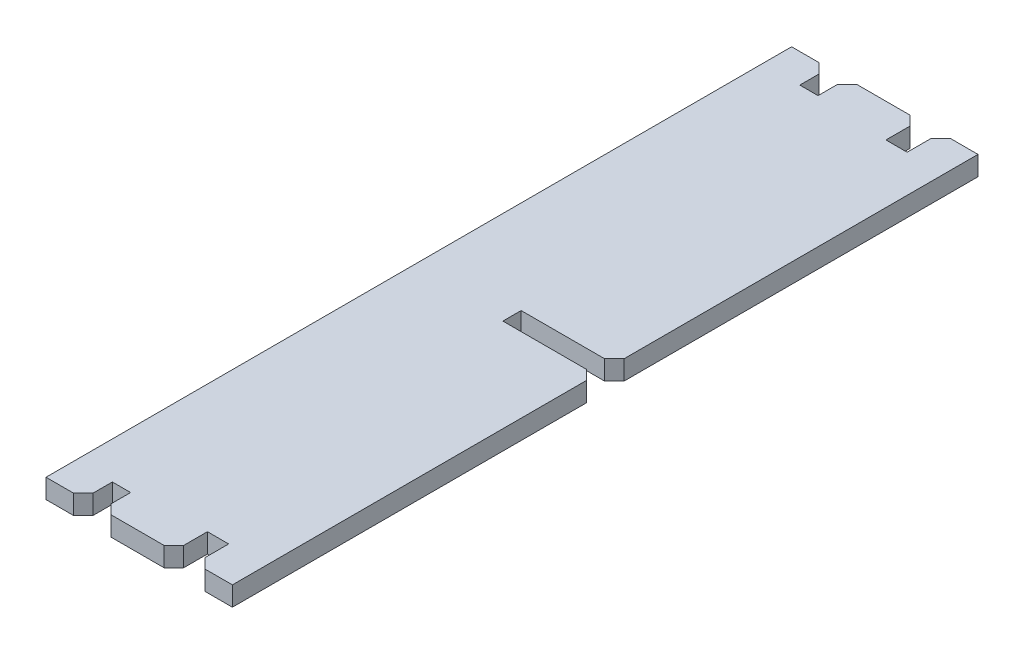
from build123d import *

# Parameters (mm, degrees)
SKETCH1_W           = 50
SKETCH1_H           = 200
BOSS_EXTRUDE1_DEPTH = 5.2
SKETCH2_W           = 4.9
SKETCH2_H           = 7.8
SKETCH2_W_2         = 5.7
SKETCH2_H_2         = 9
SKETCH2_W_3         = 25
SKETCH2_H_3         = 4.9
CUT_EXTRUDE1_DEPTH  = 5.2
CHAMFER2_SIZE       = 2.6


with BuildPart() as part:
    # Sketch1 → Boss-Extrude1 (new body)
    with BuildSketch(Plane(origin=(0, 0, 0), x_dir=(1, 0, 0), z_dir=(0, 1, 0))):
        with Locations((25, 100)):
            Rectangle(SKETCH1_W, SKETCH1_H)
    extrude(amount=BOSS_EXTRUDE1_DEPTH)

    # Sketch2 → Cut-Extrude1 (cut)
    with BuildSketch(Plane(origin=(0, 5.2, 0), x_dir=(1, 0, 0), z_dir=(0, 1, 0))):
        with Locations((12.45, 196.1)):
            Rectangle(SKETCH2_W, SKETCH2_H)
        with Locations((37.15, 195.5)):
            Rectangle(SKETCH2_W_2, SKETCH2_H_2)
        with Locations((37.5, 100)):
            Rectangle(SKETCH2_W_3, SKETCH2_H_3)
        with Locations((12.45, 3.9)):
            Rectangle(SKETCH2_W, SKETCH2_H)
        with Locations((37.15, 4.5)):
            Rectangle(SKETCH2_W_2, SKETCH2_H_2)
    extrude(amount=-CUT_EXTRUDE1_DEPTH, mode=Mode.SUBTRACT)

    # Chamfer2
    chamfer2_edges = [part.edges().sort_by_distance(p)[0] for p in [
        (10, 2.6, 0),
        (14.9, 2.6, 0),
        (34.3, 2.6, 0),
        (40, 2.6, 0),
        (50, 2.6, -102.45),
        (50, 2.6, -97.55),
        (34.3, 2.6, -200),
        (40, 2.6, -200),
        (10, 2.6, -200),
        (14.9, 2.6, -200),
    ]]
    chamfer(chamfer2_edges, length=CHAMFER2_SIZE)


solid = part.part
